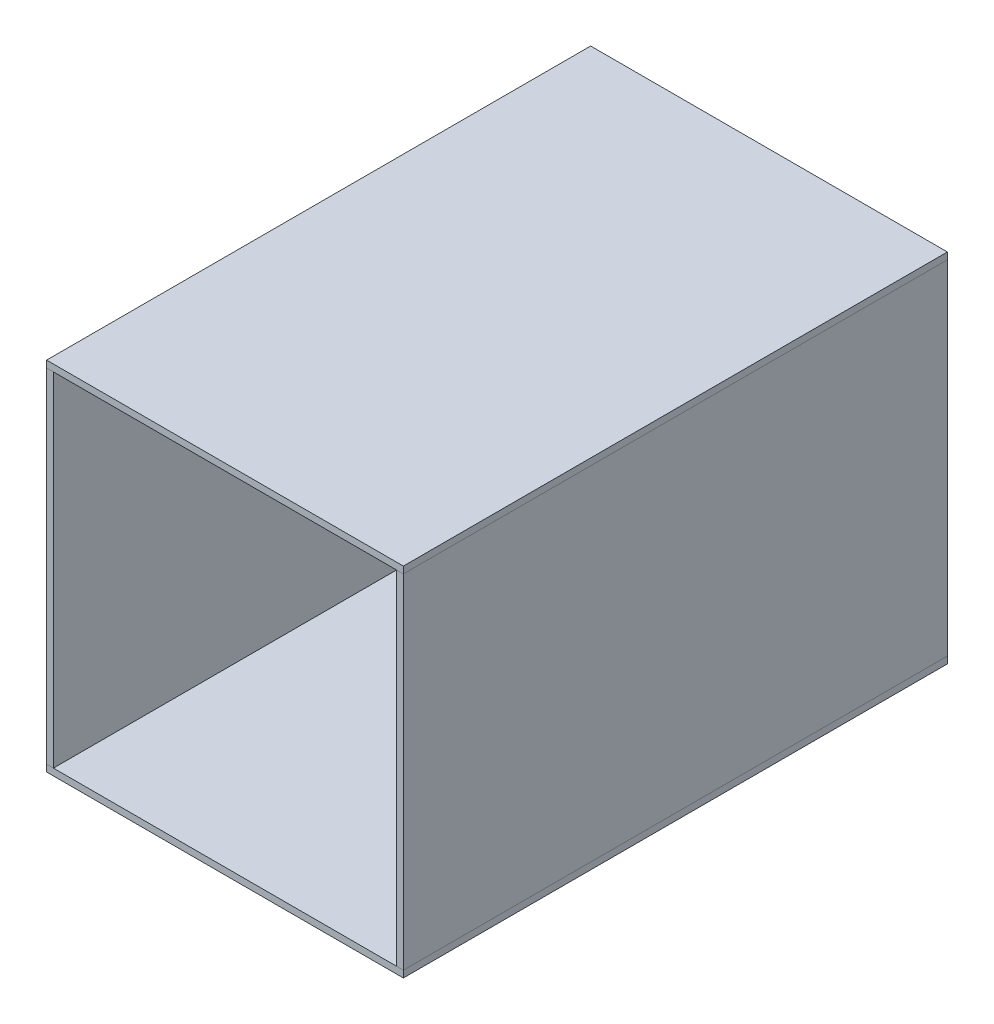
from build123d import *

# Parameters (mm, degrees)
SKETCH1_W             = 9.525
SKETCH1_H             = 480.95
BOSS_EXTRUDE1_DEPTH   = 762.5
BOSS_EXTRUDE1_2_DEPTH = 762.5
BOSS_EXTRUDE2_DEPTH   = 762.5
BOSS_EXTRUDE2_2_DEPTH = 762.5


with BuildPart() as part:
    # Sketch1 → Boss-Extrude1 (new body)
    with BuildSketch(Plane.XY):
        with Locations((-245.2375, 250)):
            Rectangle(SKETCH1_W, SKETCH1_H)
    extrude(amount=BOSS_EXTRUDE1_DEPTH)


with BuildPart() as body_2:
    # Sketch1 → Boss-Extrude1 2 (new body)
    with BuildSketch(Plane.XY):
        with Locations((245.2375, 250)):
            Rectangle(SKETCH1_W, SKETCH1_H)
    extrude(amount=BOSS_EXTRUDE1_2_DEPTH)


with BuildPart() as body_3:
    # Sketch1<3> → Boss-Extrude2 (new body)
    with BuildSketch(Plane.XY):
        Polygon((-250, 490.475), (-240.475, 490.475), (240.475, 490.475), (250, 490.475), (250, 500), (-250, 500), align=None)
    extrude(amount=BOSS_EXTRUDE2_DEPTH)


with BuildPart() as body_4:
    # Sketch1<3> → Boss-Extrude2 2 (new body)
    with BuildSketch(Plane.XY):
        Polygon((240.475, 9.525), (-240.475, 9.525), (-250, 9.525), (-250, 0), (250, 0), (250, 9.525), align=None)
    extrude(amount=BOSS_EXTRUDE2_2_DEPTH)


solid = Compound([part.part, body_2.part, body_3.part, body_4.part])
